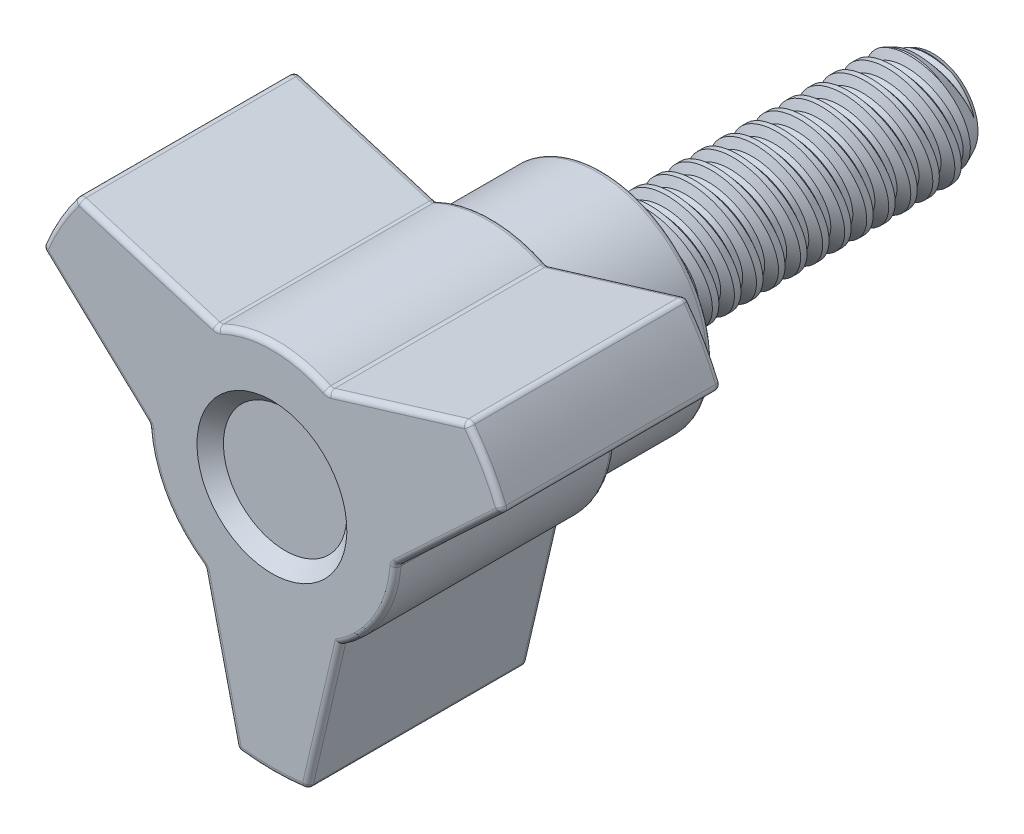
from build123d import *

# Parameters (mm, degrees)
LPATTERN1_COUNT     = 15
LPATTERN1_PITCH     = 1.27
LPATTERN1_COL_COUNT = 2
LPATTERN1_COL_PITCH = 1.27
CUT_EXTRUDE1_START  = -12.7
CUT_EXTRUDE1_DEPTH  = 12.7
CIRPATTERN1_COUNT   = 3
FILLET4_R           = 0.3175


with BuildPart() as part:
    # Sketch1 → Revolve1 (revolve)
    with BuildSketch(Plane(origin=(0, 0, 0), x_dir=(0, 0, -1), z_dir=(1, 0, 0))):
        Polygon((9.525, -2.04e-15), (-9.525, -2.04e-15), (-9.524999999999999, 3.175), (9.524999999999999, 3.175), align=None)
    revolve(axis=Axis((0, -1.83e-15, 8.5598), (0, -2.2e-16, 1)))

    # Sketch2 → Cut-Revolve1 (revolve, cut)
    with BuildSketch(Plane(origin=(0, 0, 0), x_dir=(0, 0, -1), z_dir=(1, 0, 0)), mode=Mode.PRIVATE) as cut_revolve1_sk:
        Polygon((-9.369332817734067, 3.2061334364531873), (-8.279662541872531, 3.4240674916254954), (-8.534018763159525, 2.672175228603319), (-8.845353127691391, 2.6099083556969456), align=None)
    cut_revolve1 = revolve(cut_revolve1_sk.sketch.rotate(Axis((0, -0.2727044826009153, 9.525), (0, 0.1961161351381845, -0.9805806756909201)), 180), axis=Axis((0, -0.2727044826009153, 9.525), (0, 0.1961161351381845, -0.9805806756909201)), mode=Mode.SUBTRACT)

    # LPattern1: Cut-Revolve1 ×15
    with Locations(*[(0, 0, -i * LPATTERN1_PITCH) for i in range(1, LPATTERN1_COUNT)]):
        add(cut_revolve1, mode=Mode.SUBTRACT)

    # LPattern1 col: Cut-Revolve1 ×2
    with Locations(*[(0, 0, i * LPATTERN1_COL_PITCH) for i in range(1, LPATTERN1_COL_COUNT)]):
        add(cut_revolve1, mode=Mode.SUBTRACT)

    # Sketch5 → Revolve3 (revolve)
    with BuildSketch(Plane(origin=(0, 0, 0), x_dir=(0, 0, -1), z_dir=(1, 0, 0)), mode=Mode.PRIVATE) as revolve3_sk:
        Polygon((-9.525, 6.350000000000001), (-15.875, 6.350000000000001), (-15.875, 14.287499999999998), (-28.575, 14.2875), (-28.574999999999996, -2.33e-15), (-9.525, 0), align=None)
    revolve(revolve3_sk.sketch.rotate(Axis((0, 0, 9.525), (0, -1.1e-16, -1)), 216.065043974), axis=Axis((0, 0, 9.525), (0, -1.1e-16, -1)))

    # Sketch6 → Cut-Extrude1 (cut)
    with BuildSketch(Plane.XY.offset(28.574999999999996).offset(CUT_EXTRUDE1_START)):
        with BuildLine():
            Line((11.231559927899943, 8.830895641779044), (3.193853755495176, 6.390028345086533))
            ThreePointArc((3.193853755495176, 6.390028345086533), (1.6407923500991939, 6.952766681426605), (1.85e-15, 7.143749999999996))
            Line((1.85e-15, 7.143749999999996), (5.8e-16, 17.462499999999995))
            ThreePointArc((5.8e-16, 17.462499999999995), (15.122968613585781, 8.731249999999962), (15.122968613585718, -8.731250000000072))
            Line((15.122968613585718, -8.731250000000072), (6.186668978285067, -3.571875000000031))
            ThreePointArc((6.186668978285067, -3.571875000000031), (6.841668747751056, -2.055415483192266), (7.130853755495161, -0.42905568431214713))
            Line((7.130853755495161, -0.42905568431214713), (13.263559927899935, 5.311368400799082))
            ThreePointArc((13.263559927899935, 5.311368400799082), (12.373337956570182, 7.14374999999997), (11.231559927899943, 8.830895641779044))
        make_face()
    cut_extrude1 = extrude(amount=CUT_EXTRUDE1_DEPTH, mode=Mode.SUBTRACT)

    # CirPattern1: Cut-Extrude1 ×3 about axis
    cirpattern1_axis = Axis((-1.9e-16, -3.3e-16, 0), (0, 0, 1))
    for i in range(1, CIRPATTERN1_COUNT):
        add(cut_extrude1.rotate(cirpattern1_axis, i * 360 / CIRPATTERN1_COUNT), mode=Mode.SUBTRACT)

    # Sketch10 → Cut-Revolve3 (revolve, cut)
    with BuildSketch(Plane(origin=(0, 0, 0), x_dir=(0, 0, -1), z_dir=(1, 0, 0)), mode=Mode.PRIVATE) as cut_revolve3_sk:
        Polygon((-28.574999999999996, -2.33e-15), (-28.574999999999996, 4.317999999999995), (-27.813000000000002, 3.555999999999993), (-27.813, 0), align=None)
    revolve(cut_revolve3_sk.sketch.rotate(Axis((0, -2.04e-15, -9.525), (0, -1e-17, 1)), 143.934956026), axis=Axis((0, -2.04e-15, -9.525), (0, -1e-17, 1)), mode=Mode.SUBTRACT)

    # Fillet4
    fillet4_edges = [part.edges().sort_by_distance(p)[0] for p in [
        (3.7382659227480604, 5.133017425532532, 9.525000000000002),
        (12.373337956570184, 7.143749999999971, 28.574999999999996),
        (12.373337956570184, 7.143749999999971, 15.874999999999996),
        (13.263559927899935, 5.311368400799085, 22.224999999999994),
        (6.186668978285075, -3.571875000000016, 15.874999999999996),
        (10.197206841697549, 2.4411563582434703, 15.874999999999996),
        (10.197206841697549, 2.4411563582434703, 28.574999999999996),
        (6.186668978285075, -3.571875000000016, 28.574999999999996),
        (7.130853755495162, -0.42905568431214425, 22.224999999999994),
        (7.2127068416975595, 7.610461993432791, 15.874999999999996),
        (1.789e-14, 7.14375, 15.874999999999996),
        (11.231559927899943, 8.830895641779048, 22.224999999999994),
        (3.1938537554951765, 6.390028345086535, 22.224999999999994),
        (1.789e-14, 7.14375, 28.574999999999996),
        (7.2127068416975595, 7.610461993432791, 28.574999999999996),
        (-12.37333795657015, 7.143750000000031, 28.574999999999996),
        (-12.37333795657015, 7.143750000000031, 15.874999999999996),
        (-11.231559927899902, 8.830895641779101, 22.224999999999994),
        (-7.212706841697524, 7.610461993432826, 15.874999999999996),
        (-7.212706841697524, 7.610461993432826, 28.574999999999996),
        (-3.1938537554951463, 6.3900283450865505, 22.224999999999994),
        (-3.998e-14, -14.287500000000001, 28.574999999999996),
        (-3.998e-14, -14.287500000000001, 15.874999999999996),
        (-10.197206841697536, 2.4411563582435183, 15.874999999999996),
        (-6.186668978285093, -3.571874999999984, 15.874999999999996),
        (-2.984500000000028, -10.051618351676293, 15.874999999999996),
        (-13.263559927899909, 5.311368400799147, 22.224999999999994),
        (-2.032000000000039, -14.142264042578184, 22.224999999999994),
        (-7.130853755495163, -0.4290556843121104, 22.224999999999994),
        (-2.984500000000028, -10.051618351676293, 28.574999999999996),
        (-6.186668978285093, -3.571874999999984, 28.574999999999996),
        (-10.197206841697536, 2.4411563582435183, 28.574999999999996),
        (-3.937000000000017, -5.960972660774405, 22.224999999999994),
        (2.984499999999972, -10.051618351676309, 15.874999999999996),
        (2.03199999999996, -14.142264042578192, 22.224999999999994),
        (2.984499999999972, -10.051618351676309, 28.574999999999996),
    ]]
    fillet(fillet4_edges, radius=FILLET4_R)

    # Sketch11 → Cut-Revolve4 (revolve, cut)
    with BuildSketch(Plane(origin=(0, 0, 0), x_dir=(0, 0, -1), z_dir=(1, 0, 0)), mode=Mode.PRIVATE) as cut_revolve4_sk:
        Polygon((8.254999999999999, 3.175), (9.524999999999999, 2.582789274143162), (9.524999999999999, 3.175), align=None)
    revolve(cut_revolve4_sk.sketch.rotate(Axis((0, 0, 0), (0, -2.1e-16, -1)), 216.065043974), axis=Axis((0, 0, 0), (0, -2.1e-16, -1)), mode=Mode.SUBTRACT)


solid = part.part
